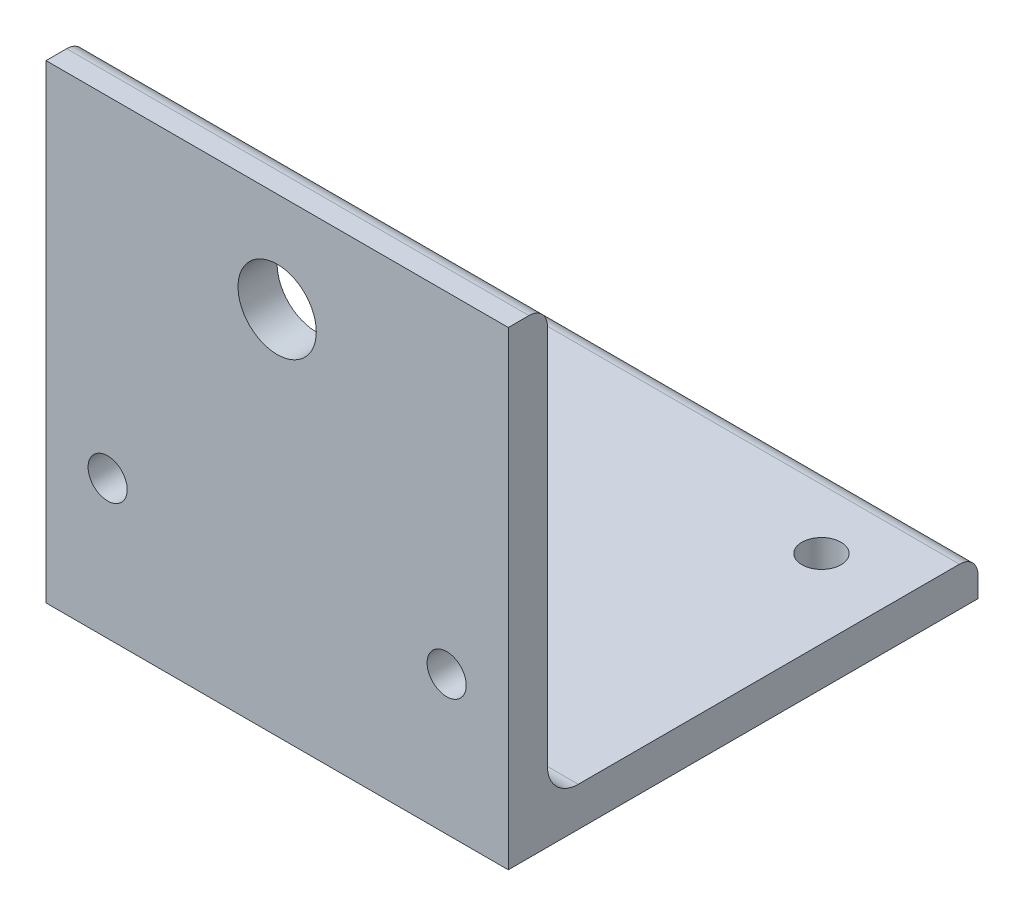
from build123d import *

# Parameters (mm, degrees)
BOSS_EXTRUDE1_DEPTH = 75
FILLET1_R           = 3
FILLET2_R           = 5
SKETCH2_R           = 6.35
CUT_EXTRUDE1_DEPTH  = 132.293107207
SKETCH3_R           = 3.175
CUT_EXTRUDE2_DEPTH  = 132.293107207
SKETCH4_R           = 3.175
CUT_EXTRUDE3_DEPTH  = 132.293107207


with BuildPart() as part:
    # Sketch1 → Boss-Extrude1 (new body)
    with BuildSketch(Plane(origin=(0, 0, 0), x_dir=(0, 0, -1), z_dir=(1, 0, 0))):
        Polygon((0, 0), (0, 76.2), (6.35, 76.2), (6.35, 6.35), (76.2, 6.35), (76.2, 0), align=None)
    extrude(amount=BOSS_EXTRUDE1_DEPTH)

    # Fillet1
    fillet1_edges = [part.edges().sort_by_distance(p)[0] for p in [
        (37.5, 76.2, -6.35),
        (37.5, 6.35, -76.2),
    ]]
    fillet(fillet1_edges, radius=FILLET1_R)

    # Fillet2
    fillet2_edges = [part.edges().sort_by_distance(p)[0] for p in [
        (37.5, 6.35, -6.35),
    ]]
    fillet(fillet2_edges, radius=FILLET2_R)

    # Sketch2 → Cut-Extrude1 (cut, through all)
    with BuildSketch(Plane(origin=(0, 0, 0), x_dir=(-1, 0, 0), z_dir=(0, 0, -1))):
        with Locations(Location((-37.5, 60, 0), (0, 0, 180))):
            Circle(SKETCH2_R)
    extrude(amount=CUT_EXTRUDE1_DEPTH, mode=Mode.SUBTRACT)

    # Sketch3 → Cut-Extrude2 (cut, through all)
    with BuildSketch(Plane.XY):
        with Locations((10, 22.5)):
            Circle(SKETCH3_R)
        with Locations((65, 22.5)):
            Circle(SKETCH3_R)
    extrude(amount=-CUT_EXTRUDE2_DEPTH, mode=Mode.SUBTRACT)

    # Sketch4 → Cut-Extrude3 (cut, through all)
    with BuildSketch(Plane.XZ):
        with Locations(Location((12.7, -63.5, 0), (0, 0, 270))):
            Circle(SKETCH4_R)
        with Locations(Location((62.3, -63.5, 0), (0, 0, 270))):
            Circle(SKETCH4_R)
    extrude(amount=-CUT_EXTRUDE3_DEPTH, mode=Mode.SUBTRACT)


solid = part.part
